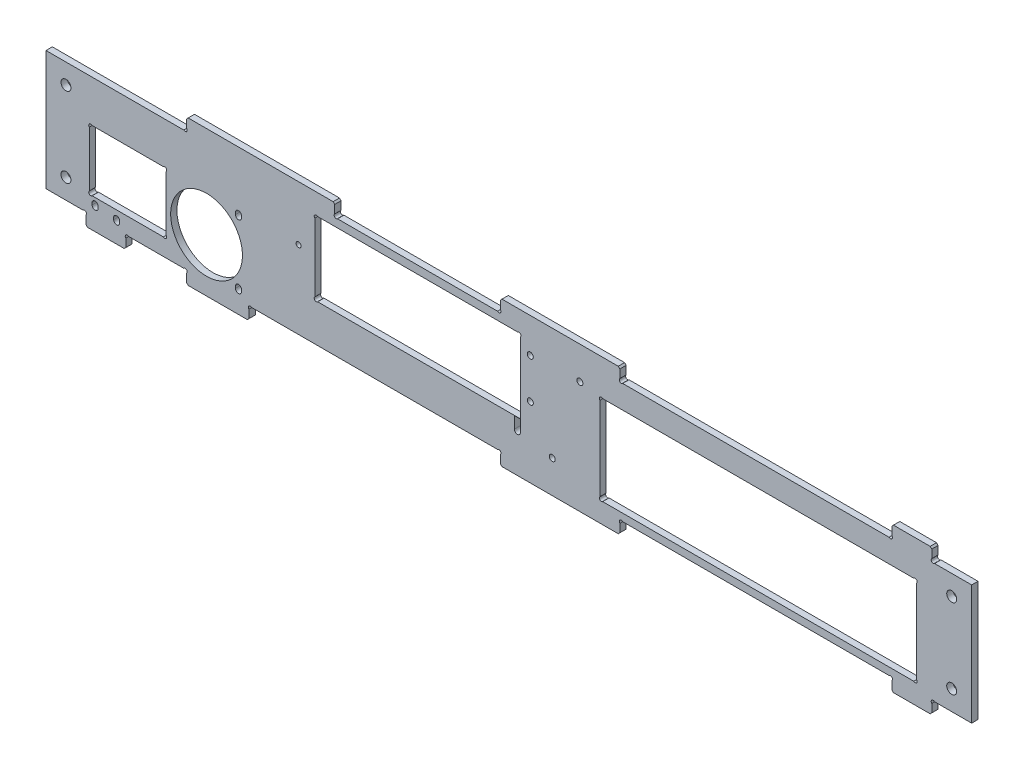
from build123d import *

# Parameters (mm, degrees)
SKETCH1_W           = 463.88
SKETCH1_H           = 60
BOSS_EXTRUDE1_DEPTH = 3.175
SKETCH7_R           = 2.5
CUT_EXTRUDE5_DEPTH  = 448.729854963
SKETCH2_R           = 1.25
SKETCH2_R_2         = 1.5
SKETCH2_W           = 103
SKETCH2_H           = 37
CUT_EXTRUDE1_DEPTH  = 448.729854963
SKETCH3_W           = 158.75
SKETCH3_H           = 44.7
CUT_EXTRUDE2_DEPTH  = 448.729854963
SKETCH4_R           = 18
SKETCH4_W           = 38.5
SKETCH4_H           = 30.5
CUT_EXTRUDE3_DEPTH  = 448.729854963
SKETCH5_W           = 31.25
SKETCH5_H           = 6.35
SKETCH5_W_2         = 20
SKETCH5_W_3         = 74.25
SKETCH5_W_4         = 59.87
BOSS_EXTRUDE2_DEPTH = 3.175
SKETCH6_R           = 1.5
CUT_EXTRUDE4_DEPTH  = 449.624949735
SKETCH8_R           = 1
CUT_EXTRUDE7_DEPTH  = 449.624949735
CHAMFER2_SIZE       = 0.8


with BuildPart() as part:
    # Sketch1 → Boss-Extrude1 (new body)
    with BuildSketch(Plane(origin=(0, 0, 0), x_dir=(-1, 0, 0), z_dir=(0, 0, -1))):
        with Locations((-211.74, 30)):
            Rectangle(SKETCH1_W, SKETCH1_H)
    extrude(amount=BOSS_EXTRUDE1_DEPTH)

    # Sketch7 → Cut-Extrude5 (cut, through all)
    with BuildSketch(Plane(origin=(0, 0, -3.175), x_dir=(-1, 0, 0), z_dir=(0, 0, -1))):
        with Locations((-433.68, 50)):
            Circle(SKETCH7_R)
        with Locations((-433.68, 10)):
            Circle(SKETCH7_R)
        with Locations((10.2, 10)):
            Circle(SKETCH7_R)
        with Locations((10.2, 50)):
            Circle(SKETCH7_R)
    extrude(amount=-CUT_EXTRUDE5_DEPTH, mode=Mode.SUBTRACT)

    # Sketch2 → Cut-Extrude1 (cut, through all)
    with BuildSketch(Plane(origin=(0, 0, -3.175), x_dir=(-1, 0, 0), z_dir=(0, 0, -1))):
        with Locations((-106.378679656, 39)):
            Circle(SKETCH2_R)
        with Locations((-222.5, 49)):
            Circle(SKETCH2_R_2)
        with Locations((-222.5, 29)):
            Circle(SKETCH2_R_2)
        with Locations((-166, 37.5)):
            Rectangle(SKETCH2_W, SKETCH2_H)
        with BuildLine():
            Line((-217.5, 13), (-217.5, 18.9))
            Line((-217.5, 18.9), (-214.5, 18.9))
            Line((-214.5, 18.9), (-214.5, 13))
            ThreePointArc((-214.5, 13), (-216, 11.5), (-217.5, 13))
        make_face()
    extrude(amount=-CUT_EXTRUDE1_DEPTH, mode=Mode.SUBTRACT)

    # Sketch3 → Cut-Extrude2 (cut, through all)
    with BuildSketch(Plane(origin=(0, 0, -3.175), x_dir=(-1, 0, 0), z_dir=(0, 0, -1))):
        with Locations((-336.745, 26.05)):
            Rectangle(SKETCH3_W, SKETCH3_H)
    extrude(amount=-CUT_EXTRUDE2_DEPTH, mode=Mode.SUBTRACT)

    # Sketch4 → Cut-Extrude3 (cut, through all)
    with BuildSketch(Plane(origin=(0, 0, -3.175), x_dir=(-1, 0, 0), z_dir=(0, 0, -1))):
        with Locations((-60.25, 20.25)):
            Circle(SKETCH4_R)
        with BuildLine():
            Line((-77.75, 4.25), (-77.75, 5.25))
            ThreePointArc((-77.75, 5.25), (-76.25, 6.75), (-74.75, 5.25))
            Line((-74.75, 5.25), (-74.75, 4.25))
            ThreePointArc((-74.75, 4.25), (-76.25, 2.75), (-77.75, 4.25))
        make_face()
        with BuildLine():
            Line((-77.75, 36.25), (-77.75, 37.25))
            ThreePointArc((-77.75, 37.25), (-76.25, 38.75), (-74.75, 37.25))
            Line((-74.75, 37.25), (-74.75, 36.25))
            ThreePointArc((-74.75, 36.25), (-76.25, 34.75), (-77.75, 36.25))
        make_face()
        with BuildLine():
            Line((-16.7, 3.5), (-16.7, 4.5))
            ThreePointArc((-16.7, 4.5), (-15.2, 6), (-13.7, 4.5))
            Line((-13.7, 4.5), (-13.7, 3.5))
            ThreePointArc((-13.7, 3.5), (-15.2, 2), (-16.7, 3.5))
        make_face()
        with BuildLine():
            Line((-5.9, 4.5), (-5.9, 5.5))
            ThreePointArc((-5.9, 5.5), (-4.4, 7), (-2.9, 5.5))
            Line((-2.9, 5.5), (-2.9, 4.5))
            ThreePointArc((-2.9, 4.5), (-4.4, 3), (-5.9, 4.5))
        make_face()
        with Locations((-20.75, 23.75)):
            Rectangle(SKETCH4_W, SKETCH4_H)
    extrude(amount=-CUT_EXTRUDE3_DEPTH, mode=Mode.SUBTRACT)

    # Sketch5 → Boss-Extrude2 (add)
    with BuildSketch(Plane(origin=(0, 0, -3.175), x_dir=(-1, 0, 0), z_dir=(0, 0, -1))):
        with Locations((-65.875, -3.175)):
            Rectangle(SKETCH5_W, SKETCH5_H)
        with Locations((-9.8, -3.175)):
            Rectangle(SKETCH5_W_2, SKETCH5_H)
        with Locations((-87.375, 63.175)):
            Rectangle(SKETCH5_W_3, SKETCH5_H)
        with Locations((-237.435, 63.175)):
            Rectangle(SKETCH5_W_4, SKETCH5_H)
        with Locations((-237.435, -3.175)):
            Rectangle(SKETCH5_W_4, SKETCH5_H)
        with Locations((-413.68, 63.175)):
            Rectangle(SKETCH5_W_2, SKETCH5_H)
        with Locations((-413.68, -3.175)):
            Rectangle(SKETCH5_W_2, SKETCH5_H)
    extrude(amount=-BOSS_EXTRUDE2_DEPTH)

    # Sketch6 → Cut-Extrude4 (cut, through all)
    with BuildSketch(Plane(origin=(0, 0, -3.175), x_dir=(-1, 0, 0), z_dir=(0, 0, -1))):
        with Locations((-247.37, 50)):
            Circle(SKETCH6_R)
        with Locations((-233.5, 10)):
            Circle(SKETCH6_R)
    extrude(amount=-CUT_EXTRUDE4_DEPTH, mode=Mode.SUBTRACT)

    # Sketch8 → Cut-Extrude7 (cut, through all)
    with BuildSketch(Plane(origin=(0, 0, -3.175), x_dir=(-1, 0, 0), z_dir=(0, 0, -1))):
        with Locations((-415.412893219, 47.692893219)):
            Circle(SKETCH8_R)
        with Locations((-258.077106781, 47.692893219)):
            Circle(SKETCH8_R)
        with Locations((-258.077106781, 4.407106781)):
            Circle(SKETCH8_R)
        with Locations((-415.412893219, 4.407106781)):
            Circle(SKETCH8_R)
        with Locations((-216.792893219, 55.292893219)):
            Circle(SKETCH8_R)
        with Locations((-115.207106781, 55.292893219)):
            Circle(SKETCH8_R)
        with Locations((-115.207106781, 19.707106781)):
            Circle(SKETCH8_R)
        with Locations((-424.387106781, 60.707106781)):
            Circle(SKETCH8_R)
        with Locations((-402.972893219, 60.707106781)):
            Circle(SKETCH8_R)
        with Locations((-268.077106781, 60.707106781)):
            Circle(SKETCH8_R)
        with Locations((-206.792893219, 60.707106781)):
            Circle(SKETCH8_R)
        with Locations((-125.207106781, 60.707106781)):
            Circle(SKETCH8_R)
        with Locations((-49.542893219, 60.707106781)):
            Circle(SKETCH8_R)
        with Locations((0.907106781, -0.707106781)):
            Circle(SKETCH8_R)
        with Locations((-20.507106781, -0.707106781)):
            Circle(SKETCH8_R)
        with Locations((-49.542893219, -0.707106781)):
            Circle(SKETCH8_R)
        with Locations((-82.207106781, -0.707106781)):
            Circle(SKETCH8_R)
        with Locations((-206.792893219, -0.707106781)):
            Circle(SKETCH8_R)
        with Locations((-268.077106781, -0.707106781)):
            Circle(SKETCH8_R)
        with Locations((-402.972893219, -0.707106781)):
            Circle(SKETCH8_R)
        with Locations((-424.387106781, -0.707106781)):
            Circle(SKETCH8_R)
        with Locations((-39.292893219, 38.292893219)):
            Circle(SKETCH8_R)
        with Locations((-2.207106781, 38.292893219)):
            Circle(SKETCH8_R)
        with Locations((-39.292893219, 9.207106781)):
            Circle(SKETCH8_R)
        with Locations((-2.207106781, 9.207106781)):
            Circle(SKETCH8_R)
    extrude(amount=-CUT_EXTRUDE7_DEPTH, mode=Mode.SUBTRACT)

    # Chamfer2
    chamfer2_edges = [part.edges().sort_by_distance(p)[0] for p in [
        (81.5, -6.35, -1.5875),
        (50.25, -6.35, -1.5875),
        (19.8, -6.35, -1.5875),
        (-0.2, -6.35, -1.5875),
        (124.5, 66.35, -1.5875),
        (50.25, 66.35, -1.5875),
        (267.37, 66.35, -1.5875),
        (207.5, 66.35, -1.5875),
        (267.37, -6.35, -1.5875),
        (207.5, -6.35, -1.5875),
        (423.68, -6.35, -1.5875),
        (403.68, -6.35, -1.5875),
        (403.68, 66.35, -1.5875),
        (423.68, 66.35, -1.5875),
    ]]
    chamfer(chamfer2_edges, length=CHAMFER2_SIZE)


solid = part.part
